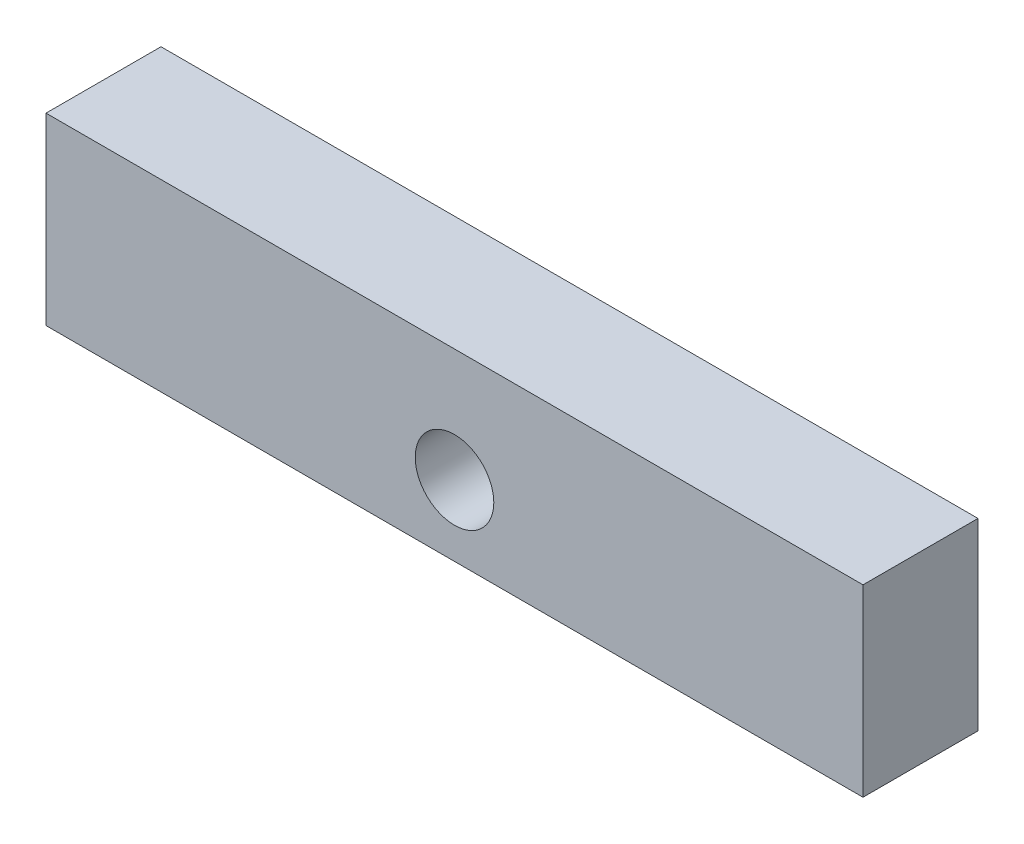
from build123d import *

# Parameters (mm, degrees)
SKETCH_1_W          = 106.57
SKETCH_1_H          = 24
EXTRUDE_1_DEPTH     = 15
SKETCH_2_R          = 5.125
CUT_EXTRUDE_1_DEPTH = 15


with BuildPart() as part:
    # Эскиз1 → Бобышка-Вытянуть1 (new body)
    with BuildSketch(Plane.XY):
        with Locations((-10.692538812, 20.838028771)):
            Rectangle(SKETCH_1_W, SKETCH_1_H)
    extrude(amount=EXTRUDE_1_DEPTH)

    # Эскиз2 → Вырез-Вытянуть1 (cut)
    with BuildSketch(Plane.XY.offset(15)):
        with Locations((-10.692538812, 18.049320442)):
            Circle(SKETCH_2_R)
    extrude(amount=-CUT_EXTRUDE_1_DEPTH, mode=Mode.SUBTRACT)


solid = part.part
